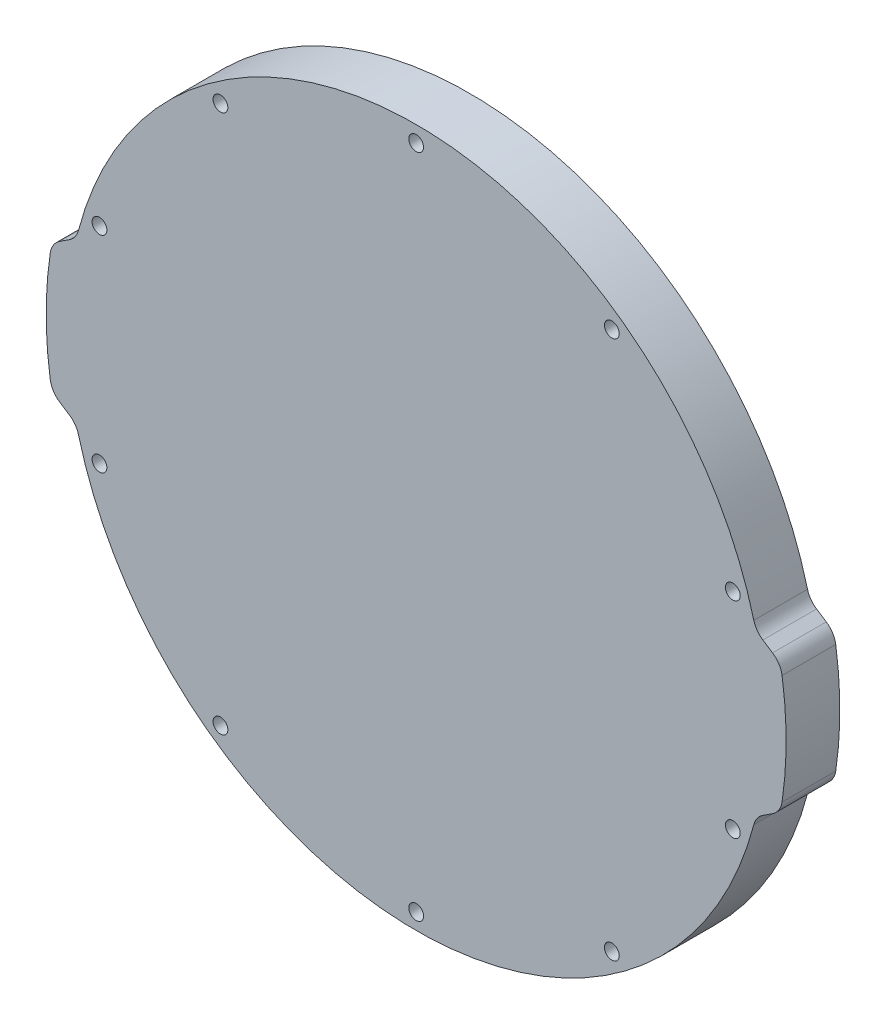
from build123d import *

# Parameters (mm, degrees)
SKETCH1_R           = 1.75
BOSS_EXTRUDE1_DEPTH = 6.35
FILLET1_R           = 5.08


with BuildPart() as part:
    # Sketch1 → Boss-Extrude1 (new, symmetric)
    with BuildSketch(Plane.XY):
        with BuildLine():
            Line((-86.162592811, 15.24), (-80.321852568, 19.05))
            ThreePointArc((-80.321852568, 19.05), (0, 82.55), (80.321852568, 19.05))
            Line((80.321852568, 19.05), (86.162592811, 15.24))
            ThreePointArc((86.162592811, 15.24), (87.5, 0), (86.162592811, -15.24))
            Line((86.162592811, -15.24), (80.321852568, -19.05))
            ThreePointArc((80.321852568, -19.05), (0, -82.55), (-80.321852568, -19.05))
            Line((-80.321852568, -19.05), (-86.162592811, -15.24))
            ThreePointArc((-86.162592811, -15.24), (-87.5, 0), (-86.162592811, 15.24))
        make_face()
        with Locations((0, 78.74)):
            Circle(SKETCH1_R, mode=Mode.SUBTRACT)
        with Locations((46.282210766, 63.701998137)):
            Circle(SKETCH1_R, mode=Mode.SUBTRACT)
        with Locations((74.886190093, 24.331998137)):
            Circle(SKETCH1_R, mode=Mode.SUBTRACT)
        with Locations((74.886190093, -24.331998137)):
            Circle(SKETCH1_R, mode=Mode.SUBTRACT)
        with Locations((46.282210766, -63.701998137)):
            Circle(SKETCH1_R, mode=Mode.SUBTRACT)
        with Locations((0, -78.74)):
            Circle(SKETCH1_R, mode=Mode.SUBTRACT)
        with Locations((-46.282210766, -63.701998137)):
            Circle(SKETCH1_R, mode=Mode.SUBTRACT)
        with Locations((-74.886190093, -24.331998137)):
            Circle(SKETCH1_R, mode=Mode.SUBTRACT)
        with Locations((-74.886190093, 24.331998137)):
            Circle(SKETCH1_R, mode=Mode.SUBTRACT)
        with Locations((-46.282210766, 63.701998137)):
            Circle(SKETCH1_R, mode=Mode.SUBTRACT)
    extrude(amount=BOSS_EXTRUDE1_DEPTH, both=True)

    # Fillet1
    fillet1_edges = [part.edges().sort_by_distance(p)[0] for p in [
        (-86.162592811, -15.24, 0),
        (-86.162592811, 15.24, 0),
        (-80.321852568, 19.05, 0),
        (80.321852568, 19.05, 0),
        (86.162592811, 15.24, 0),
        (86.162592811, -15.24, 0),
        (80.321852568, -19.05, 0),
        (-80.321852568, -19.05, 0),
    ]]
    fillet(fillet1_edges, radius=FILLET1_R)


solid = part.part
